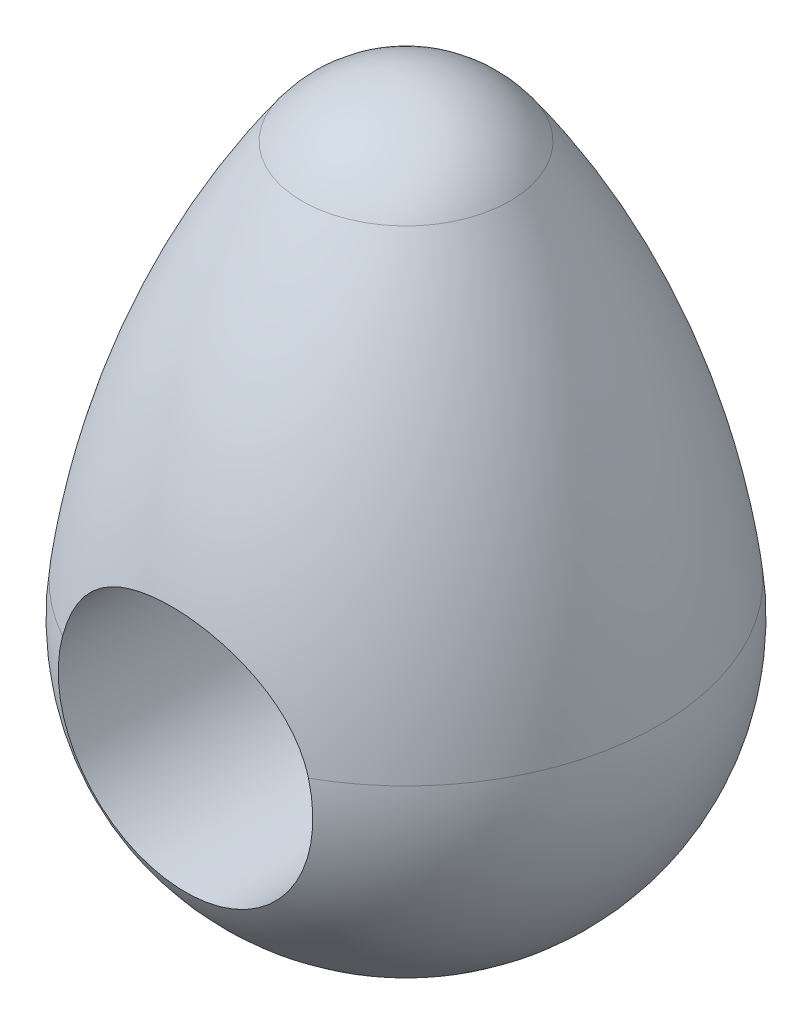
from build123d import *

# Parameters (mm, degrees)
CUT_EXTRUDE1_DEPTH      = 89.217019333
CUT_EXTRUDE1_DEPTH_BACK = 89.217019333
SKETCH2_R               = 19.05


with BuildPart() as part:
    # Sketch1 → Revolve4 (revolve)
    with BuildSketch(Plane.XY):
        with BuildLine():
            Line((0, -38.1), (0, 0))
            Line((0, 0), (0, 69.85))
            ThreePointArc((0, 69.85), (-8.758796786, 67.717032212), (-15.556204448, 61.795772059))
            ThreePointArc((-15.556204448, 61.795772059), (-30.1355237, 34.719437324), (-37.77935366, 4.932589286))
            ThreePointArc((-37.77935366, 4.932589286), (-28.631640293, -25.136411321), (0, -38.1))
        make_face()
    revolve(axis=Axis((0, 0, 0), (0, 1, 0)))

    # Sketch2 → Cut-Extrude1 (cut, two sides: drawn at the far end of the back side and taken through both)
    with BuildSketch(Plane.XY.offset(-CUT_EXTRUDE1_DEPTH_BACK)):
        with Locations(Location((0, 0, 0), (0, 0, 15.006496867))):
            Circle(SKETCH2_R)
    extrude(amount=CUT_EXTRUDE1_DEPTH + CUT_EXTRUDE1_DEPTH_BACK, mode=Mode.SUBTRACT)


solid = part.part
